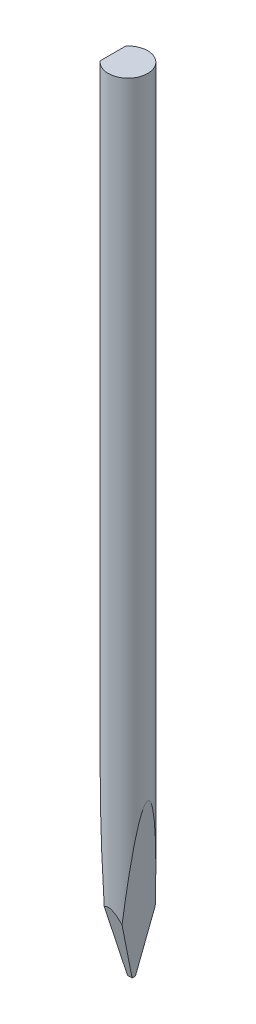
from build123d import *

# Parameters (mm, degrees)
TD_SKETCH_R                  = 1.58623
TL_FEATURE_DEPTH             = 63.5
TDF_SKETCH_W                 = 3.19246
TDF_SKETCH_H                 = 3.19246
TDF_FEATURE_DEPTH            = 64.53961167
ISA_FEATURE_DEPTH            = 64.53961167
ISA_FEATURE_DEPTH_BACK       = 64.53961167
STD_SHANK_FEATURE_DEPTH      = 64.53961167
STD_SHANK_FEATURE_DEPTH_BACK = 64.53961167


with BuildPart() as part:
    # TD_sketch → TL_feature (new body)
    with BuildSketch(Plane(origin=(0, 0, 0), x_dir=(1, 0, 0), z_dir=(0, 1, 0))):
        with Locations(Location((0, 0, 0), (0, 0, 270))):
            Circle(TD_SKETCH_R)
    extrude(amount=TL_FEATURE_DEPTH)

    # TDF_sketch → TDF_feature (cut, through all)
    with BuildSketch(Plane(origin=(0, 0, 0), x_dir=(1, 0, 0), z_dir=(0, 1, 0))):
        with Locations((-2.804, 0)):
            Rectangle(TDF_SKETCH_W, TDF_SKETCH_H)
    extrude(amount=TDF_FEATURE_DEPTH, mode=Mode.SUBTRACT)

    # ISA_sketch → ISA_feature (cut, two sides: drawn at the far end of the back side and taken through both)
    with BuildSketch(Plane(origin=(0, 0, 0), x_dir=(0, 0, -1), z_dir=(1, 0, 0)).offset(-ISA_FEATURE_DEPTH_BACK)):
        Polygon((-54.007028628, 201.05930583), (-17.148123719, 63.5), (-0.13335, 0), (0.13335, 0), (17.148123719, 63.5), (54.007028628, 201.05930583), (54.007028628, -83.764439609), (-54.007028628, -83.764439609), align=None)
    extrude(amount=ISA_FEATURE_DEPTH + ISA_FEATURE_DEPTH_BACK, mode=Mode.SUBTRACT)

    # STD_shank_sketch → STD_shank_feature (cut, two sides: drawn at the far end of the back side and taken through both)
    with BuildSketch(Plane.XY.offset(-STD_SHANK_FEATURE_DEPTH_BACK)):
        Polygon((-17.472069957, 200.795385926), (-5.460280134, 63.5), (0.09525, 0), (0.46355, 0), (6.019080134, 63.5), (18.030869957, 200.795385926), (18.030869957, -74.844278065), (-17.472069957, -74.844278065), align=None)
    extrude(amount=STD_SHANK_FEATURE_DEPTH + STD_SHANK_FEATURE_DEPTH_BACK, mode=Mode.SUBTRACT)


solid = part.part
